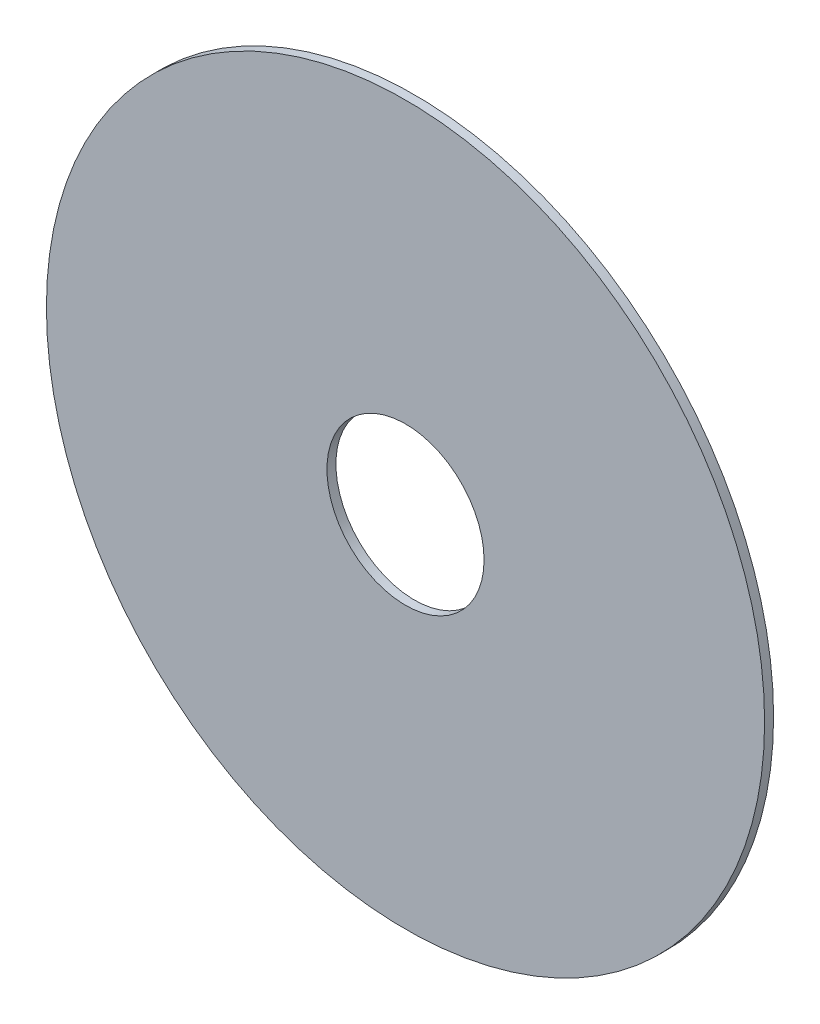
from build123d import *

# Parameters (mm, degrees)
SKETCH1_R           = 80
BOSS_EXTRUDE1_DEPTH = 2
SKETCH3_R           = 17.5
CUT_EXTRUDE1_DEPTH  = 2


with BuildPart() as part:
    # Sketch1 → Boss-Extrude1 (new body)
    with BuildSketch(Plane.XY):
        Circle(SKETCH1_R)
    extrude(amount=BOSS_EXTRUDE1_DEPTH)

    # Sketch3 → Cut-Extrude1 (cut)
    with BuildSketch(Plane.XY.offset(2)):
        Circle(SKETCH3_R)
    extrude(amount=-CUT_EXTRUDE1_DEPTH, mode=Mode.SUBTRACT)


solid = part.part
